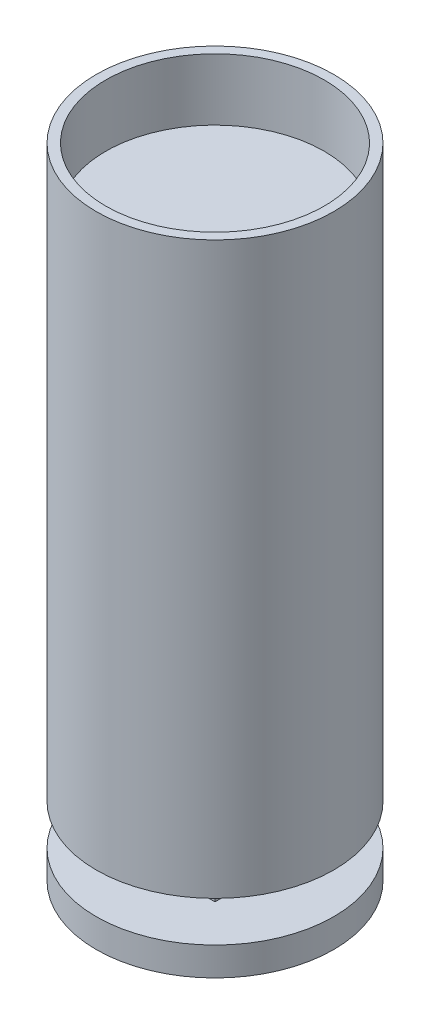
from build123d import *

# Parameters (mm, degrees)
SKETCH1_R           = 12.5
BOSS_EXTRUDE1_DEPTH = 1.5
SKETCH2_W           = 9.8
SKETCH2_H           = 9.8
BOSS_EXTRUDE2_DEPTH = 4.25
SKETCH3_R           = 12.5
BOSS_EXTRUDE3_DEPTH = 47.5
SKETCH4_R           = 12.5
BOSS_EXTRUDE4_DEPTH = 3
SKETCH5_R           = 12.5
SKETCH5_R_2         = 11.5
BOSS_EXTRUDE5_DEPTH = 6.5


with BuildPart() as part:
    # Sketch1 → Boss-Extrude1 (new, symmetric)
    with BuildSketch(Plane(origin=(0, 0, 0), x_dir=(1, 0, 0), z_dir=(0, 1, 0))):
        with Locations(Location((0, 0, 0), (0, 0, 270))):
            Circle(SKETCH1_R)
    boss_extrude1 = extrude(amount=BOSS_EXTRUDE1_DEPTH, both=True)

    # Sketch2 → Boss-Extrude2 (add)
    with BuildSketch(Plane(origin=(0, 1.5, 0), x_dir=(1, 0, 0), z_dir=(0, 1, 0))):
        Rectangle(SKETCH2_W, SKETCH2_H)
    extrude(amount=BOSS_EXTRUDE2_DEPTH)

    # Mirror1: Boss-Extrude1 across plane
    add(boss_extrude1.mirror(Plane.ZX.offset(3.625)))

    # Sketch3 → Boss-Extrude3 (add)
    with BuildSketch(Plane(origin=(0, 8.75, 0), x_dir=(1, 0, 0), z_dir=(0, 1, 0))):
        with Locations(Location((0, 0, 0), (0, 0, 270))):
            Circle(SKETCH3_R)
    extrude(amount=BOSS_EXTRUDE3_DEPTH)

    # Sketch4 → Boss-Extrude4 (add)
    with BuildSketch(Plane(origin=(0, 56.25, 0), x_dir=(1, 0, 0), z_dir=(0, 1, 0))):
        with Locations(Location((0, 0, 0), (0, 0, 270))):
            Circle(SKETCH4_R)
    extrude(amount=BOSS_EXTRUDE4_DEPTH)

    # Sketch5 → Boss-Extrude5 (add)
    with BuildSketch(Plane(origin=(0, 59.25, 0), x_dir=(1, 0, 0), z_dir=(0, 1, 0))):
        with Locations(Location((0, 0, 0), (0, 0, 270))):
            Circle(SKETCH5_R)
        with Locations(Location((0, 0, 0), (0, 0, 90))):
            Circle(SKETCH5_R_2, mode=Mode.SUBTRACT)
    extrude(amount=BOSS_EXTRUDE5_DEPTH)


solid = part.part
